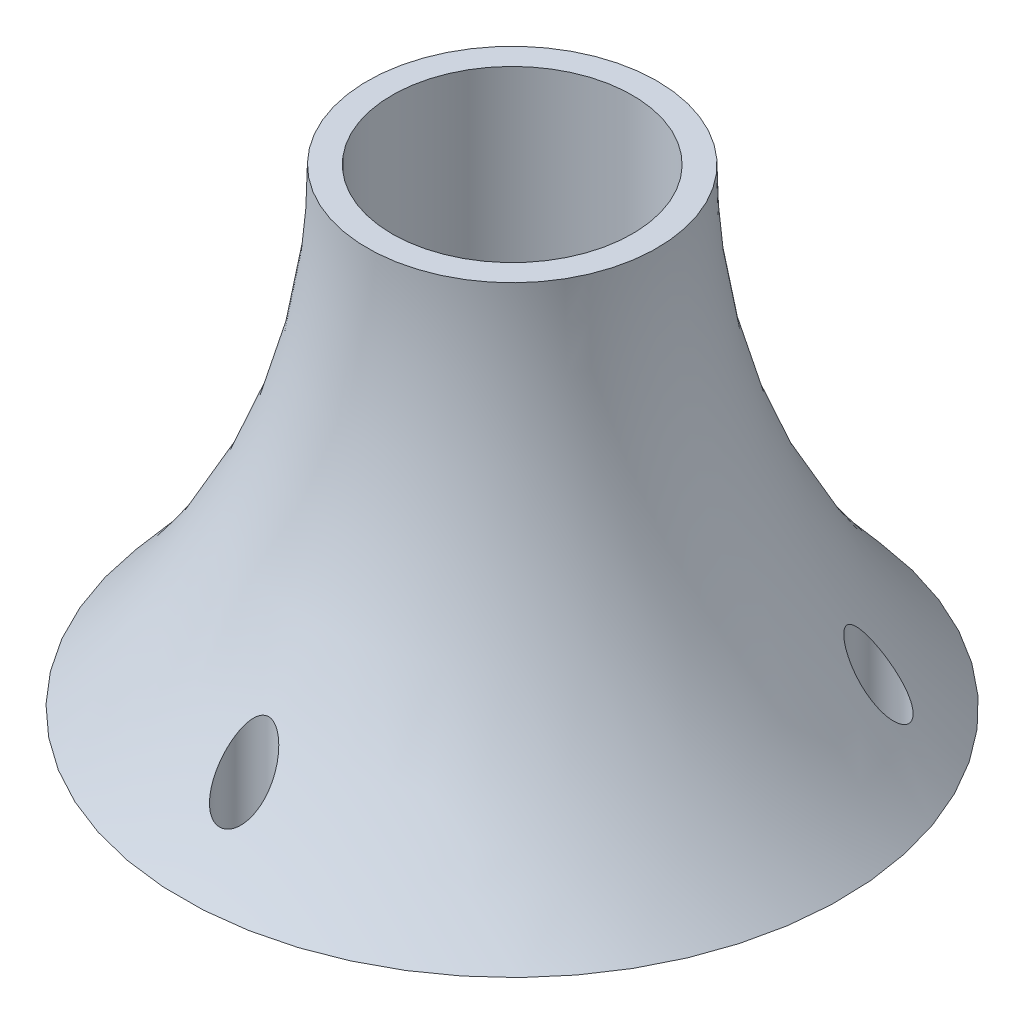
from build123d import *

# Parameters (mm, degrees)
SKETCH1_R           = 29.845
SKETCH1_R_2         = 24.765
BOSS_EXTRUDE1_DEPTH = 97.07
SKETCH4_R           = 24.765
SKETCH4_R_2         = 5.05
CUT_EXTRUDE1_DEPTH  = 95


with BuildPart() as part:
    # Sketch1 → Boss-Extrude1 (new body)
    with BuildSketch(Plane(origin=(0, 0, 0), x_dir=(1, 0, 0), z_dir=(0, 1, 0))):
        with Locations(Location((0, 0, 0), (0, 0, 270))):
            Circle(SKETCH1_R)
        with Locations(Location((0, 0, 0), (0, 0, 270))):
            Circle(SKETCH1_R_2, mode=Mode.SUBTRACT)
    extrude(amount=BOSS_EXTRUDE1_DEPTH)

    # Sketch3 → Revolve1 (revolve)
    with BuildSketch(Plane.XY, mode=Mode.PRIVATE) as revolve1_sk:
        with BuildLine():
            Line((67.945, 0), (29.845, 0))
            Line((29.845, 0), (29.845, 97.07))
            ThreePointArc((29.845, 97.07), (39.711046991, 44.930296079), (67.945, 0))
        make_face()
    revolve(revolve1_sk.sketch.rotate(Axis((0, 0, 0), (0, 1, 0)), 90), axis=Axis((0, 0, 0), (0, 1, 0)))

    # Sketch4 → Cut-Extrude1 (cut)
    with BuildSketch(Plane.XZ):
        with Locations(Location((0, 0, 0), (0, 0, 90))):
            Circle(SKETCH4_R)
        with Locations(Location((0, 55.245, 0), (0, 0, 270))):
            Circle(SKETCH4_R_2)
        with Locations(Location((47.843573432, -27.6225, 0), (0, 0, 270))):
            Circle(SKETCH4_R_2)
        with Locations(Location((-47.843573432, -27.6225, 0), (0, 0, 270))):
            Circle(SKETCH4_R_2)
    extrude(amount=-CUT_EXTRUDE1_DEPTH, mode=Mode.SUBTRACT)


solid = part.part
